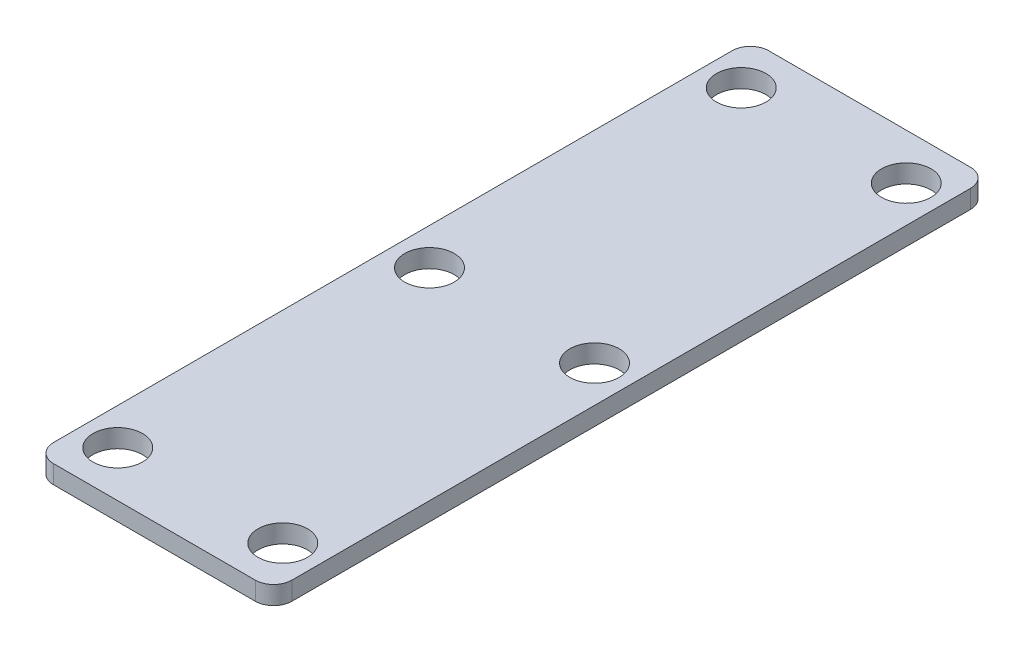
from build123d import *

# Parameters (mm, degrees)
SKETCH1_W           = 13
SKETCH1_H           = 39
BOSS_EXTRUDE1_DEPTH = 1
SKETCH2_R           = 1.35
CUT_EXTRUDE1_DEPTH  = 21.579115627
FILLET1_R           = 1


with BuildPart() as part:
    # Sketch1 → Boss-Extrude1 (new body)
    with BuildSketch(Plane(origin=(0, 0, 0), x_dir=(1, 0, 0), z_dir=(0, 1, 0))):
        Rectangle(SKETCH1_W, SKETCH1_H)
    extrude(amount=BOSS_EXTRUDE1_DEPTH)

    # Sketch2 → Cut-Extrude1 (cut, through all)
    with BuildSketch(Plane(origin=(0, 1, 0), x_dir=(1, 0, 0), z_dir=(0, 1, 0))):
        with Locations(Location((4.5, 0, 0), (0, 0, 270))):
            Circle(SKETCH2_R)
        with Locations(Location((4.5, -17, 0), (0, 0, 270))):
            Circle(SKETCH2_R)
        with Locations(Location((4.5, 17, 0), (0, 0, 270))):
            Circle(SKETCH2_R)
        with Locations(Location((-4.5, 0, 0), (0, 0, 270))):
            Circle(SKETCH2_R)
        with Locations(Location((-4.5, 17, 0), (0, 0, 270))):
            Circle(SKETCH2_R)
        with Locations(Location((-4.5, -17, 0), (0, 0, 270))):
            Circle(SKETCH2_R)
    extrude(amount=-CUT_EXTRUDE1_DEPTH, mode=Mode.SUBTRACT)

    # Fillet1
    fillet1_edges = [part.edges().sort_by_distance(p)[0] for p in [
        (6.5, 0.5, 19.5),
        (-6.5, 0.5, 19.5),
        (-6.5, 0.5, -19.5),
        (6.5, 0.5, -19.5),
    ]]
    fillet(fillet1_edges, radius=FILLET1_R)


solid = part.part
